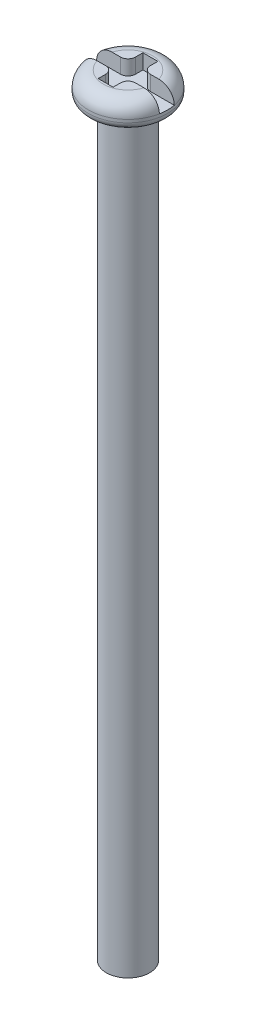
from build123d import *

# Parameters (mm, degrees)
SKETCH_1_R          = 1.45
EXTRUDE_1_DEPTH     = 50
SKETCH_2_R          = 2.65
EXTRUDE_2_DEPTH     = 1.7
CUT_EXTRUDE_START   = -1
SKETCH_3_W          = 1
SKETCH_3_H          = 1
CUT_EXTRUDE_1_DEPTH = 1
FILLET_1_R          = 0.5
FILLET_2_R          = 1
FILLET_3_R          = 0.5


with BuildPart() as part:
    # 草图1 → 凸台-拉伸1 (new body)
    with BuildSketch(Plane(origin=(0, 0, 0), x_dir=(1, 0, 0), z_dir=(0, 1, 0))):
        with Locations(Location((0, 0, 0), (0, 0, 270))):
            Circle(SKETCH_1_R)
    extrude(amount=EXTRUDE_1_DEPTH)

    # 草图2 → 凸台-拉伸2 (add)
    with BuildSketch(Plane(origin=(0, 50, 0), x_dir=(1, 0, 0), z_dir=(0, 1, 0))):
        with Locations(Location((0, 0, 0), (0, 0, 270))):
            Circle(SKETCH_2_R)
    extrude(amount=EXTRUDE_2_DEPTH)

    # 草图3 → 切除-拉伸1 (cut)
    with BuildSketch(Plane(origin=(0, 51.7, 0), x_dir=(1, 0, 0), z_dir=(0, 1, 0)).offset(CUT_EXTRUDE_START)):
        with BuildLine():
            Line((-0.5, 0.5), (-2.602402736, 0.5))
            ThreePointArc((-2.602402736, 0.5), (-2.65, 0), (-2.602402736, -0.5))
            Line((-2.602402736, -0.5), (-0.5, -0.5))
            Line((-0.5, -0.5), (-0.5, 0.5))
        make_face()
        with Locations((0, 1)):
            Rectangle(SKETCH_3_W, SKETCH_3_H)
        Rectangle(SKETCH_3_W, SKETCH_3_H)
        with Locations((0, -1)):
            Rectangle(SKETCH_3_W, SKETCH_3_H)
        with BuildLine():
            ThreePointArc((2.65, 0), (2.638073848, 0.251130195), (2.602402736, 0.5))
            Line((2.602402736, 0.5), (0.5, 0.5))
            Line((0.5, 0.5), (0.5, -0.5))
            Line((0.5, -0.5), (2.602402736, -0.5))
            ThreePointArc((2.602402736, -0.5), (2.638073848, -0.251130195), (2.65, 0))
        make_face()
    extrude(amount=CUT_EXTRUDE_1_DEPTH, mode=Mode.SUBTRACT)

    # 圆角1
    fillet_1_edges = [part.edges().sort_by_distance(p)[0] for p in [
        (-0.5, 51.2, 0.5),
        (-0.5, 51.2, -0.5),
        (0.5, 51.2, -0.5),
        (0.5, 51.2, 0.5),
    ]]
    fillet(fillet_1_edges, radius=FILLET_1_R)

    # 圆角2
    fillet_2_edges = [part.edges().sort_by_distance(p)[0] for p in [
        (0, 51.7, -2.65),
        (1.687824043, 51.7, 2.042975771),
    ]]
    fillet(fillet_2_edges, radius=FILLET_2_R)

    # 圆角3
    fillet_3_edges = [part.edges().sort_by_distance(p)[0] for p in [
        (0, 50, -2.65),
    ]]
    fillet(fillet_3_edges, radius=FILLET_3_R)


solid = part.part
